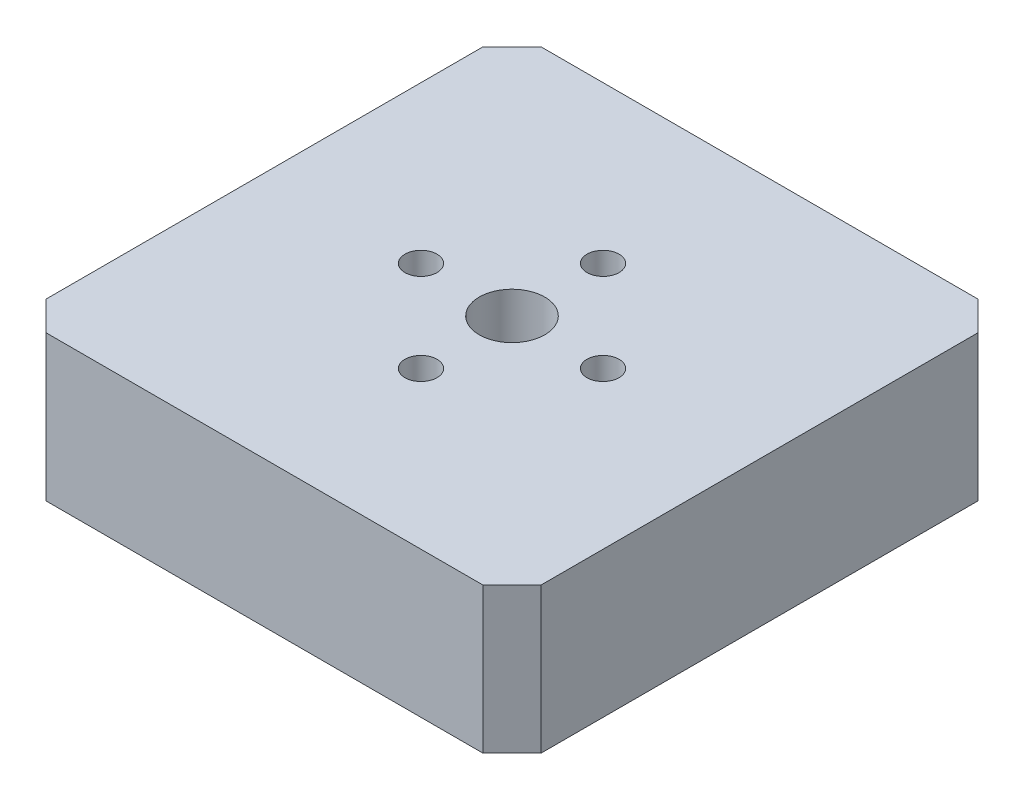
from build123d import *

# Parameters (mm, degrees)
SKETCH_1_W                   = 34
SKETCH_1_H                   = 34
SKETCH_1_R                   = 2.25
EXTRUDE_1_DEPTH              = 10
SKETCH_1_3_W                 = 30
SKETCH_1_3_H                 = 30
SKETCH_1_3_R                 = 2.25
CUT_EXTRUDE_1_DEPTH          = 6
CHAMFER_1_SIZE               = 2
HOLE_WIZARD_M2_1_D           = 2.2
HOLE_WIZARD_M2_1_CBORE_D     = 4.3
HOLE_WIZARD_M2_1_CBORE_DEPTH = 2.3


with BuildPart() as part:
    # 草图1 → 凸台-拉伸1 (new body)
    with BuildSketch(Plane(origin=(0, 0, 0), x_dir=(1, 0, 0), z_dir=(0, 1, 0))):
        Rectangle(SKETCH_1_W, SKETCH_1_H)
        Circle(SKETCH_1_R, mode=Mode.SUBTRACT)
    extrude(amount=EXTRUDE_1_DEPTH)

    # 草图1<3> → 切除-拉伸1 (cut)
    with BuildSketch(Plane(origin=(0, 0, 0), x_dir=(1, 0, 0), z_dir=(0, 1, 0))):
        Rectangle(SKETCH_1_3_W, SKETCH_1_3_H)
        Circle(SKETCH_1_3_R, mode=Mode.SUBTRACT)
    extrude(amount=CUT_EXTRUDE_1_DEPTH, mode=Mode.SUBTRACT)

    # 倒角1
    chamfer_1_edges = [part.edges().sort_by_distance(p)[0] for p in [
        (-15, 3, -15),
        (15, 3, -15),
        (15, 3, 15),
        (-15, 3, 15),
        (-17, 5, 17),
        (17, 5, 17),
        (17, 5, -17),
        (-17, 5, -17),
    ]]
    chamfer(chamfer_1_edges, length=CHAMFER_1_SIZE)

    # M2 六角圆柱头螺钉的柱形沉头孔1 (through all)
    with Locations(Plane(origin=(0, 6, 0), x_dir=(-1, 0, 0), z_dir=(0, -1, 0))):
        with Locations((0, 6.25), (6.25, 0), (0, -6.25), (-6.25, 0)):
            CounterBoreHole(HOLE_WIZARD_M2_1_D / 2, HOLE_WIZARD_M2_1_CBORE_D / 2, HOLE_WIZARD_M2_1_CBORE_DEPTH)


solid = part.part
